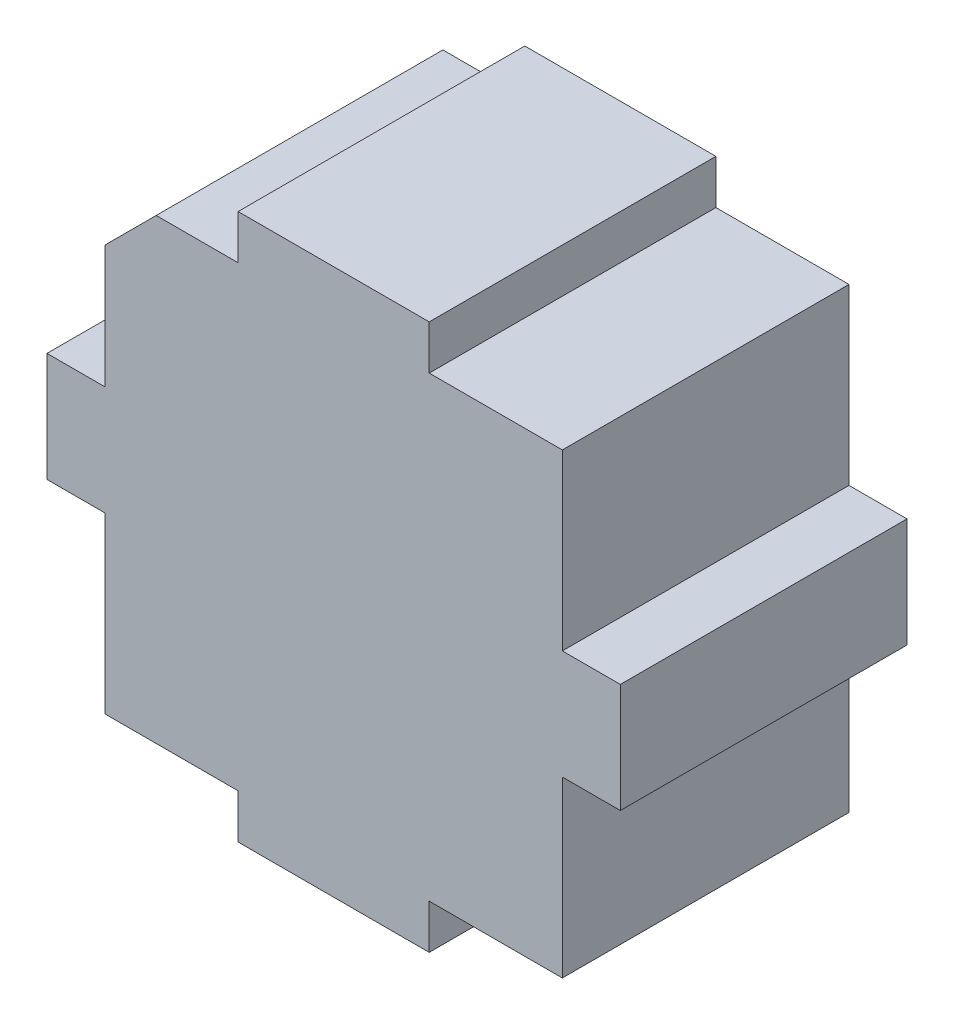
from build123d import *

# Parameters (mm, degrees)
COMPONENT_OUTLINE_DEPTH = 2.1


with BuildPart() as part:
    # 草图1 → Component_Outline (new body)
    with BuildSketch(Plane.XY):
        Polygon((0.7, 2), (0.7, 1.675), (1.675, 1.675), (1.675, 0.4), (2.1, 0.4), (2.1, -0.4), (1.675, -0.4), (1.675, -1.675), (0.7, -1.675), (0.7, -2), (-0.7, -2), (-0.7, -1.675), (-1.675, -1.675), (-1.675, -0.4), (-2.1, -0.4), (-2.1, 0.4), (-1.675, 0.4), (-1.675, 1.3), (-1.3, 1.675), (-0.7, 1.675), (-0.7, 2), align=None)
    extrude(amount=COMPONENT_OUTLINE_DEPTH)


solid = part.part
